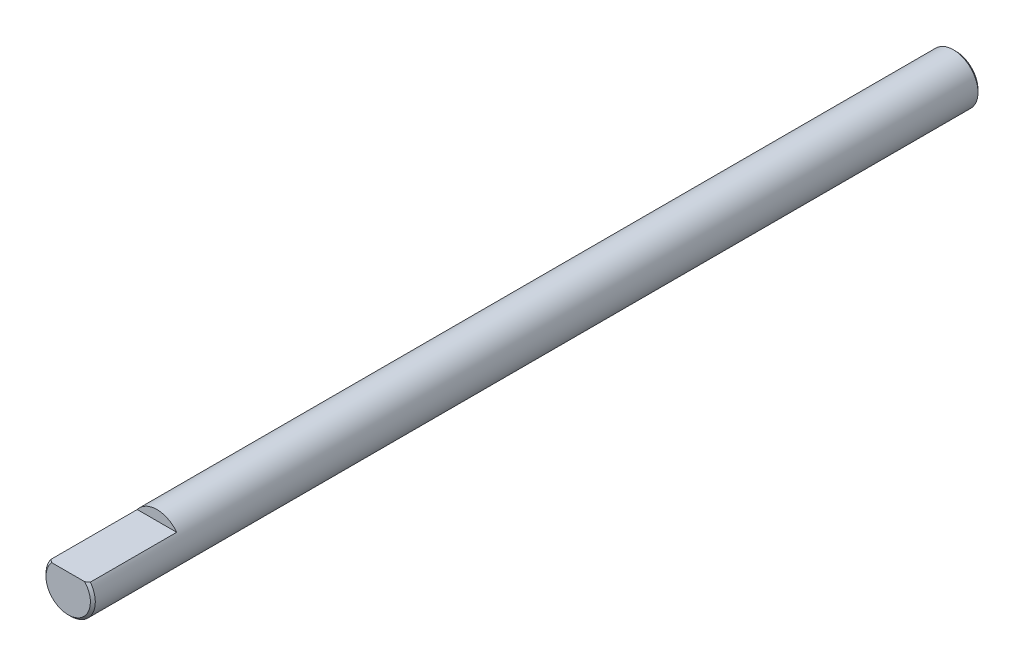
from build123d import *

# Parameters (mm, degrees)
SKETCH1_R           = 2.5
BOSS_EXTRUDE1_DEPTH = 90
SKETCH2_W           = 7.942505736
SKETCH2_H           = 1
CUT_EXTRUDE1_DEPTH  = 9
CHAMFER1_SIZE       = 0.25


with BuildPart() as part:
    # Sketch1 → Boss-Extrude1 (new body)
    with BuildSketch(Plane.XY):
        with Locations(Location((0, 0, 0), (0, 0, 180))):
            Circle(SKETCH1_R)
    extrude(amount=BOSS_EXTRUDE1_DEPTH)

    # Sketch2 → Cut-Extrude1 (cut)
    with BuildSketch(Plane.XY.offset(90)):
        with Locations((-0.051574713, 2)):
            Rectangle(SKETCH2_W, SKETCH2_H)
    extrude(amount=-CUT_EXTRUDE1_DEPTH, mode=Mode.SUBTRACT)

    # Chamfer1
    chamfer1_edges = [part.edges().sort_by_distance(p)[0] for p in [
        (2.5, 0, 0),
        (0.790569415, -2.371708245, 90),
    ]]
    chamfer(chamfer1_edges, length=CHAMFER1_SIZE)


solid = part.part
